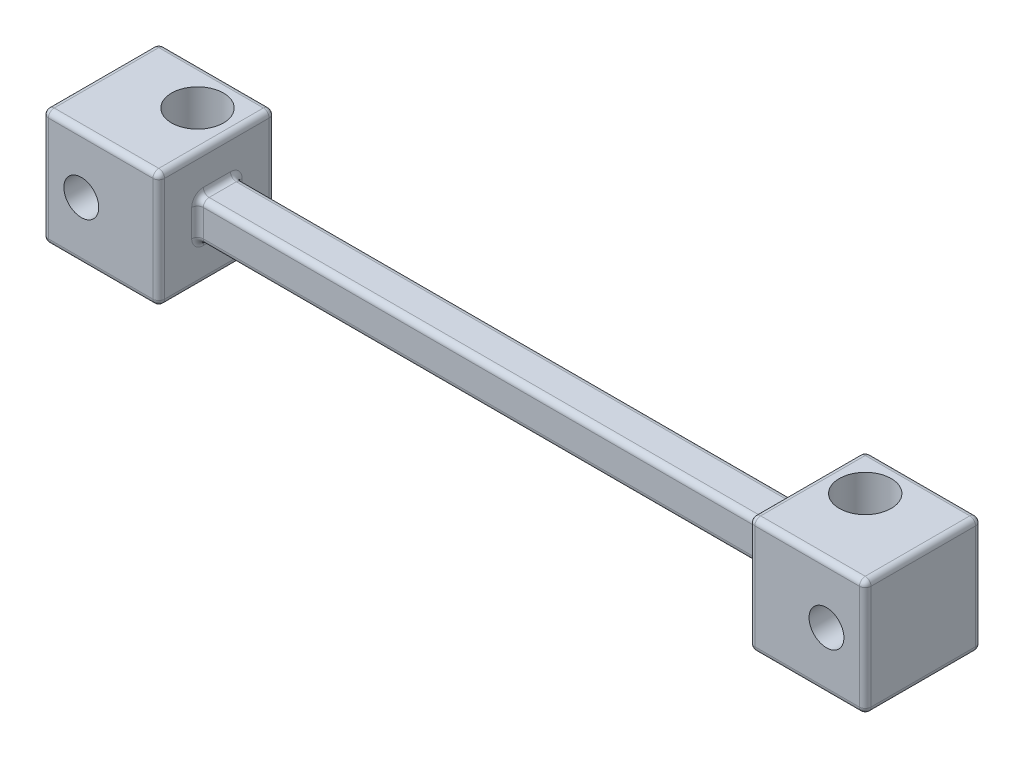
from build123d import *

# Parameters (mm, degrees)
BOSS_EXTRUDE1_START = -10
SKETCH1_W           = 30
SKETCH1_H           = 30
BOSS_EXTRUDE1_DEPTH = 30
SKETCH2_W           = 10
SKETCH2_H           = 10
BOSS_EXTRUDE2_DEPTH = 152.4
SKETCH3_W           = 6
SKETCH3_H           = 6
CUT_EXTRUDE1_DEPTH  = 152.4
SKETCH4_R           = 6.7
CUT_EXTRUDE2_DEPTH  = 15
SKETCH5_R           = 4.5
CUT_EXTRUDE3_DEPTH  = 15
FILLET3_R           = 1.5


with BuildPart() as part:
    # Sketch1 → Boss-Extrude1 (new body)
    with BuildSketch(Plane(origin=(0, 0, 0), x_dir=(0, 0, -1), z_dir=(1, 0, 0)).offset(BOSS_EXTRUDE1_START)):
        with Locations((15, 15)):
            Rectangle(SKETCH1_W, SKETCH1_H)
    boss_extrude1 = extrude(amount=BOSS_EXTRUDE1_DEPTH)

    # Sketch2 → Boss-Extrude2 (add)
    with BuildSketch(Plane(origin=(20, 0, 0), x_dir=(0, 0, -1), z_dir=(1, 0, 0))):
        with Locations((15, 15)):
            Rectangle(SKETCH2_W, SKETCH2_H)
    extrude(amount=BOSS_EXTRUDE2_DEPTH)

    # Sketch3 → Cut-Extrude1 (cut)
    with BuildSketch(Plane(origin=(172.4, 0, 0), x_dir=(0, 0, -1), z_dir=(1, 0, 0))):
        with Locations((15, 15)):
            Rectangle(SKETCH3_W, SKETCH3_H)
    extrude(amount=-CUT_EXTRUDE1_DEPTH, mode=Mode.SUBTRACT)

    # Sketch4 → Cut-Extrude2 (cut)
    with BuildSketch(Plane(origin=(0, 30, 0), x_dir=(1, 0, 0), z_dir=(0, 1, 0))):
        with Locations(Location((10, 20, 0), (0, 0, 270))):
            Circle(SKETCH4_R)
    cut_extrude2 = extrude(amount=-CUT_EXTRUDE2_DEPTH, mode=Mode.SUBTRACT)

    # Sketch5 → Cut-Extrude3 (cut)
    with BuildSketch(Plane.XY):
        with Locations((0, 15)):
            Circle(SKETCH5_R)
    cut_extrude3 = extrude(amount=-CUT_EXTRUDE3_DEPTH, mode=Mode.SUBTRACT)

    # Mirror1: Boss-Extrude1, Cut-Extrude2, Cut-Extrude3 across plane
    add(boss_extrude1.mirror(Plane(origin=(96.2, 0, 0), x_dir=(0, 0, 1), z_dir=(1, 0, 0))))
    add(cut_extrude2.mirror(Plane(origin=(96.2, 0, 0), x_dir=(0, 0, 1), z_dir=(1, 0, 0))), mode=Mode.SUBTRACT)
    add(cut_extrude3.mirror(Plane(origin=(96.2, 0, 0), x_dir=(0, 0, 1), z_dir=(1, 0, 0))), mode=Mode.SUBTRACT)

    # Fillet3
    fillet3_edges = [part.edges().sort_by_distance(p)[0] for p in [
        (20, 30, -15),
        (20, 15, 0),
        (20, 0, -15),
        (-10, 30, -15),
        (20, 15, -30),
        (-10, 15, 0),
        (20, 15, -10),
        (96.2, 20, -10),
        (20, 10, -15),
        (96.2, 10, -10),
        (20, 15, -20),
        (96.2, 10, -20),
        (20, 20, -15),
        (96.2, 20, -20),
        (172.4, 15, -10),
        (172.4, 10, -15),
        (172.4, 15, -20),
        (172.4, 20, -15),
        (-10, 0, -15),
        (187.4, 0, 0),
        (172.4, 0, -15),
        (187.4, 0, -30),
        (172.4, 15, -30),
        (187.4, 30, -30),
        (202.4, 30, -15),
        (187.4, 30, 0),
        (202.4, 15, 0),
        (202.4, 0, -15),
        (202.4, 15, -30),
        (172.4, 15, 0),
        (172.4, 30, -15),
        (5, 0, 0),
        (5, 30, 0),
        (5, 30, -30),
        (5, 0, -30),
        (-10, 15, -30),
    ]]
    fillet(fillet3_edges, radius=FILLET3_R)


solid = part.part
